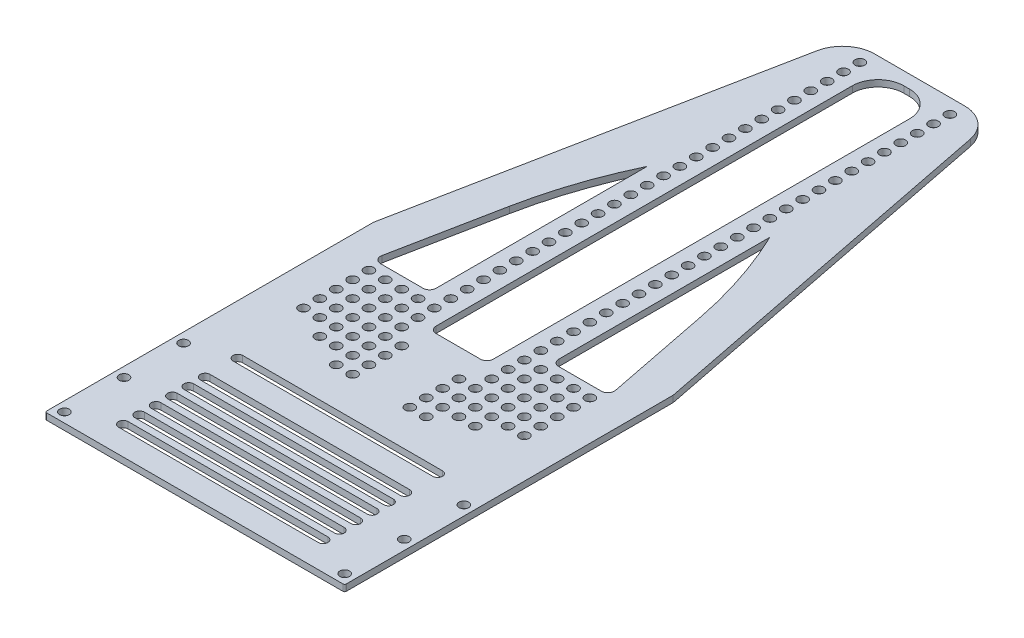
from build123d import *

# Parameters (mm, degrees)
SKETCH_1_R      = 1.5
EXTRUDE_1_DEPTH = 2


with BuildPart() as part:
    # 스케치1 → 보스-돌출1 (new body)
    with BuildSketch(Plane(origin=(0, 0, 0), x_dir=(1, 0, 0), z_dir=(0, 1, 0))):
        with BuildLine():
            Line((-13.97, 75), (13.97, 75))
            ThreePointArc((13.97, 75), (20.318558496, 72.72630604), (23.780181171, 66.939161004))
            Line((23.780181171, 66.939161004), (46.5, -48))
            Line((46.5, -48), (46.5, -149.5))
            ThreePointArc((46.5, -149.5), (46.353553391, -149.853553391), (46, -150))
            Line((46, -150), (-46, -150))
            ThreePointArc((-46, -150), (-46.353553391, -149.853553391), (-46.5, -149.5))
            Line((-46.5, -149.5), (-46.5, -48))
            Line((-46.5, -48), (-23.780181171, 66.939161004))
            ThreePointArc((-23.780181171, 66.939161004), (-20.318558496, 72.72630604), (-13.97, 75))
        make_face()
        with Locations(Location((-13.97, 65.34, 0), (0, 0, 270))):
            Circle(SKETCH_1_R, mode=Mode.SUBTRACT)
        with Locations(Location((-13.97, 60.26, 0), (0, 0, 270))):
            Circle(SKETCH_1_R, mode=Mode.SUBTRACT)
        with Locations(Location((-13.97, 70.42, 0), (0, 0, 270))):
            Circle(SKETCH_1_R, mode=Mode.SUBTRACT)
        with Locations(Location((-13.97, 55.18, 0), (0, 0, 270))):
            Circle(SKETCH_1_R, mode=Mode.SUBTRACT)
        with Locations(Location((-13.97, 50.1, 0), (0, 0, 270))):
            Circle(SKETCH_1_R, mode=Mode.SUBTRACT)
        with Locations(Location((-13.97, 45.02, 0), (0, 0, 270))):
            Circle(SKETCH_1_R, mode=Mode.SUBTRACT)
        with Locations(Location((-13.97, 39.94, 0), (0, 0, 270))):
            Circle(SKETCH_1_R, mode=Mode.SUBTRACT)
        with Locations(Location((-13.97, 34.86, 0), (0, 0, 270))):
            Circle(SKETCH_1_R, mode=Mode.SUBTRACT)
        with Locations(Location((-13.97, 29.78, 0), (0, 0, 270))):
            Circle(SKETCH_1_R, mode=Mode.SUBTRACT)
        with Locations(Location((-13.97, 24.7, 0), (0, 0, 270))):
            Circle(SKETCH_1_R, mode=Mode.SUBTRACT)
        with Locations(Location((-13.97, 19.62, 0), (0, 0, 270))):
            Circle(SKETCH_1_R, mode=Mode.SUBTRACT)
        with Locations(Location((-13.97, 14.54, 0), (0, 0, 270))):
            Circle(SKETCH_1_R, mode=Mode.SUBTRACT)
        with Locations(Location((-13.97, 9.46, 0), (0, 0, 270))):
            Circle(SKETCH_1_R, mode=Mode.SUBTRACT)
        with Locations(Location((-13.97, 4.38, 0), (0, 0, 270))):
            Circle(SKETCH_1_R, mode=Mode.SUBTRACT)
        with Locations(Location((-13.97, -0.7, 0), (0, 0, 270))):
            Circle(SKETCH_1_R, mode=Mode.SUBTRACT)
        with Locations(Location((-13.97, -5.78, 0), (0, 0, 270))):
            Circle(SKETCH_1_R, mode=Mode.SUBTRACT)
        with Locations(Location((-13.97, -10.86, 0), (0, 0, 270))):
            Circle(SKETCH_1_R, mode=Mode.SUBTRACT)
        with Locations(Location((-13.97, -15.94, 0), (0, 0, 270))):
            Circle(SKETCH_1_R, mode=Mode.SUBTRACT)
        with Locations(Location((-13.97, -21.02, 0), (0, 0, 270))):
            Circle(SKETCH_1_R, mode=Mode.SUBTRACT)
        with Locations(Location((-13.97, -26.1, 0), (0, 0, 270))):
            Circle(SKETCH_1_R, mode=Mode.SUBTRACT)
        with Locations(Location((-13.97, -31.18, 0), (0, 0, 270))):
            Circle(SKETCH_1_R, mode=Mode.SUBTRACT)
        with Locations(Location((-13.97, -36.26, 0), (0, 0, 270))):
            Circle(SKETCH_1_R, mode=Mode.SUBTRACT)
        with Locations(Location((-13.97, -41.34, 0), (0, 0, 270))):
            Circle(SKETCH_1_R, mode=Mode.SUBTRACT)
        with Locations(Location((-13.97, -46.42, 0), (0, 0, 270))):
            Circle(SKETCH_1_R, mode=Mode.SUBTRACT)
        with Locations(Location((-13.97, -51.5, 0), (0, 0, 270))):
            Circle(SKETCH_1_R, mode=Mode.SUBTRACT)
        with Locations(Location((-13.97, -56.58, 0), (0, 0, 270))):
            Circle(SKETCH_1_R, mode=Mode.SUBTRACT)
        with Locations(Location((-13.97, -61.66, 0), (0, 0, 270))):
            Circle(SKETCH_1_R, mode=Mode.SUBTRACT)
        with Locations(Location((-13.97, -66.74, 0), (0, 0, 270))):
            Circle(SKETCH_1_R, mode=Mode.SUBTRACT)
        with Locations(Location((-13.97, -71.82, 0), (0, 0, 270))):
            Circle(SKETCH_1_R, mode=Mode.SUBTRACT)
        with Locations(Location((-13.97, -76.9, 0), (0, 0, 270))):
            Circle(SKETCH_1_R, mode=Mode.SUBTRACT)
        with Locations(Location((-13.97, -81.98, 0), (0, 0, 270))):
            Circle(SKETCH_1_R, mode=Mode.SUBTRACT)
        with Locations(Location((-13.97, -87.06, 0), (0, 0, 270))):
            Circle(SKETCH_1_R, mode=Mode.SUBTRACT)
        with Locations(Location((-13.97, -92.14, 0), (0, 0, 270))):
            Circle(SKETCH_1_R, mode=Mode.SUBTRACT)
        with Locations(Location((-19.05, -61.66, 0), (0, 0, 270))):
            Circle(SKETCH_1_R, mode=Mode.SUBTRACT)
        with Locations(Location((-19.05, -66.74, 0), (0, 0, 270))):
            Circle(SKETCH_1_R, mode=Mode.SUBTRACT)
        with Locations(Location((-19.05, -71.82, 0), (0, 0, 270))):
            Circle(SKETCH_1_R, mode=Mode.SUBTRACT)
        with Locations(Location((-19.05, -76.9, 0), (0, 0, 270))):
            Circle(SKETCH_1_R, mode=Mode.SUBTRACT)
        with Locations(Location((-19.05, -81.98, 0), (0, 0, 270))):
            Circle(SKETCH_1_R, mode=Mode.SUBTRACT)
        with Locations(Location((-19.05, -87.06, 0), (0, 0, 270))):
            Circle(SKETCH_1_R, mode=Mode.SUBTRACT)
        with Locations(Location((-24.13, -61.66, 0), (0, 0, 270))):
            Circle(SKETCH_1_R, mode=Mode.SUBTRACT)
        with Locations(Location((-24.13, -66.74, 0), (0, 0, 270))):
            Circle(SKETCH_1_R, mode=Mode.SUBTRACT)
        with Locations(Location((-24.13, -71.82, 0), (0, 0, 270))):
            Circle(SKETCH_1_R, mode=Mode.SUBTRACT)
        with Locations(Location((-24.13, -76.9, 0), (0, 0, 270))):
            Circle(SKETCH_1_R, mode=Mode.SUBTRACT)
        with Locations(Location((-24.13, -81.98, 0), (0, 0, 270))):
            Circle(SKETCH_1_R, mode=Mode.SUBTRACT)
        with Locations(Location((-24.13, -87.06, 0), (0, 0, 270))):
            Circle(SKETCH_1_R, mode=Mode.SUBTRACT)
        with Locations(Location((-29.21, -61.66, 0), (0, 0, 270))):
            Circle(SKETCH_1_R, mode=Mode.SUBTRACT)
        with Locations(Location((-29.21, -66.74, 0), (0, 0, 270))):
            Circle(SKETCH_1_R, mode=Mode.SUBTRACT)
        with Locations(Location((-29.21, -71.82, 0), (0, 0, 270))):
            Circle(SKETCH_1_R, mode=Mode.SUBTRACT)
        with Locations(Location((-29.21, -76.9, 0), (0, 0, 270))):
            Circle(SKETCH_1_R, mode=Mode.SUBTRACT)
        with Locations(Location((-29.21, -81.98, 0), (0, 0, 270))):
            Circle(SKETCH_1_R, mode=Mode.SUBTRACT)
        with Locations(Location((-8.89, -76.9, 0), (0, 0, 270))):
            Circle(SKETCH_1_R, mode=Mode.SUBTRACT)
        with Locations(Location((-34.29, -61.66, 0), (0, 0, 270))):
            Circle(SKETCH_1_R, mode=Mode.SUBTRACT)
        with Locations(Location((-34.29, -66.74, 0), (0, 0, 270))):
            Circle(SKETCH_1_R, mode=Mode.SUBTRACT)
        with Locations(Location((-34.29, -71.82, 0), (0, 0, 270))):
            Circle(SKETCH_1_R, mode=Mode.SUBTRACT)
        with Locations(Location((-34.29, -76.9, 0), (0, 0, 270))):
            Circle(SKETCH_1_R, mode=Mode.SUBTRACT)
        with Locations(Location((-8.89, -81.98, 0), (0, 0, 270))):
            Circle(SKETCH_1_R, mode=Mode.SUBTRACT)
        with Locations(Location((-8.89, -87.06, 0), (0, 0, 270))):
            Circle(SKETCH_1_R, mode=Mode.SUBTRACT)
        with Locations(Location((-8.89, -92.14, 0), (0, 0, 270))):
            Circle(SKETCH_1_R, mode=Mode.SUBTRACT)
        with Locations(Location((13.97, 39.94, 0), (0, 0, 90))):
            Circle(SKETCH_1_R, mode=Mode.SUBTRACT)
        with Locations(Location((13.97, 45.02, 0), (0, 0, 90))):
            Circle(SKETCH_1_R, mode=Mode.SUBTRACT)
        with Locations(Location((13.97, 50.1, 0), (0, 0, 90))):
            Circle(SKETCH_1_R, mode=Mode.SUBTRACT)
        with Locations(Location((13.97, 55.18, 0), (0, 0, 90))):
            Circle(SKETCH_1_R, mode=Mode.SUBTRACT)
        with Locations(Location((13.97, 70.42, 0), (0, 0, 90))):
            Circle(SKETCH_1_R, mode=Mode.SUBTRACT)
        with Locations(Location((13.97, 60.26, 0), (0, 0, 90))):
            Circle(SKETCH_1_R, mode=Mode.SUBTRACT)
        with Locations(Location((13.97, 65.34, 0), (0, 0, 90))):
            Circle(SKETCH_1_R, mode=Mode.SUBTRACT)
        with Locations(Location((13.97, -41.34, 0), (0, 0, 90))):
            Circle(SKETCH_1_R, mode=Mode.SUBTRACT)
        with Locations(Location((13.97, -36.26, 0), (0, 0, 90))):
            Circle(SKETCH_1_R, mode=Mode.SUBTRACT)
        with Locations(Location((13.97, -31.18, 0), (0, 0, 90))):
            Circle(SKETCH_1_R, mode=Mode.SUBTRACT)
        with Locations(Location((13.97, -26.1, 0), (0, 0, 90))):
            Circle(SKETCH_1_R, mode=Mode.SUBTRACT)
        with Locations(Location((13.97, -21.02, 0), (0, 0, 90))):
            Circle(SKETCH_1_R, mode=Mode.SUBTRACT)
        with Locations(Location((13.97, -15.94, 0), (0, 0, 90))):
            Circle(SKETCH_1_R, mode=Mode.SUBTRACT)
        with Locations(Location((13.97, -10.86, 0), (0, 0, 90))):
            Circle(SKETCH_1_R, mode=Mode.SUBTRACT)
        with Locations(Location((13.97, -5.78, 0), (0, 0, 90))):
            Circle(SKETCH_1_R, mode=Mode.SUBTRACT)
        with Locations(Location((13.97, -0.7, 0), (0, 0, 90))):
            Circle(SKETCH_1_R, mode=Mode.SUBTRACT)
        with Locations(Location((13.97, 4.38, 0), (0, 0, 90))):
            Circle(SKETCH_1_R, mode=Mode.SUBTRACT)
        with Locations(Location((-43.5, -147, 0), (0, 0, 270))):
            Circle(SKETCH_1_R, mode=Mode.SUBTRACT)
        with Locations(Location((-43.5, -110, 0), (0, 0, 270))):
            Circle(SKETCH_1_R, mode=Mode.SUBTRACT)
        with Locations(Location((-43.5, -128.5, 0), (0, 0, 270))):
            Circle(SKETCH_1_R, mode=Mode.SUBTRACT)
        with Locations(Location((43.5, -147, 0), (0, 0, 90))):
            Circle(SKETCH_1_R, mode=Mode.SUBTRACT)
        with Locations(Location((43.5, -128.5, 0), (0, 0, 90))):
            Circle(SKETCH_1_R, mode=Mode.SUBTRACT)
        with Locations(Location((43.5, -110, 0), (0, 0, 90))):
            Circle(SKETCH_1_R, mode=Mode.SUBTRACT)
        with Locations(Location((13.97, 9.46, 0), (0, 0, 90))):
            Circle(SKETCH_1_R, mode=Mode.SUBTRACT)
        with Locations(Location((13.97, 14.54, 0), (0, 0, 90))):
            Circle(SKETCH_1_R, mode=Mode.SUBTRACT)
        with Locations(Location((13.97, 19.62, 0), (0, 0, 90))):
            Circle(SKETCH_1_R, mode=Mode.SUBTRACT)
        with Locations(Location((13.97, 24.7, 0), (0, 0, 90))):
            Circle(SKETCH_1_R, mode=Mode.SUBTRACT)
        with Locations(Location((13.97, 29.78, 0), (0, 0, 90))):
            Circle(SKETCH_1_R, mode=Mode.SUBTRACT)
        with Locations(Location((13.97, 34.86, 0), (0, 0, 90))):
            Circle(SKETCH_1_R, mode=Mode.SUBTRACT)
        with Locations(Location((13.97, -66.74, 0), (0, 0, 90))):
            Circle(SKETCH_1_R, mode=Mode.SUBTRACT)
        with Locations(Location((34.29, -66.74, 0), (0, 0, 90))):
            Circle(SKETCH_1_R, mode=Mode.SUBTRACT)
        with Locations(Location((29.21, -66.74, 0), (0, 0, 90))):
            Circle(SKETCH_1_R, mode=Mode.SUBTRACT)
        with Locations(Location((24.13, -66.74, 0), (0, 0, 90))):
            Circle(SKETCH_1_R, mode=Mode.SUBTRACT)
        with Locations(Location((19.05, -66.74, 0), (0, 0, 90))):
            Circle(SKETCH_1_R, mode=Mode.SUBTRACT)
        with Locations(Location((34.29, -61.66, 0), (0, 0, 90))):
            Circle(SKETCH_1_R, mode=Mode.SUBTRACT)
        with Locations(Location((29.21, -61.66, 0), (0, 0, 90))):
            Circle(SKETCH_1_R, mode=Mode.SUBTRACT)
        with Locations(Location((24.13, -61.66, 0), (0, 0, 90))):
            Circle(SKETCH_1_R, mode=Mode.SUBTRACT)
        with Locations(Location((19.05, -61.66, 0), (0, 0, 90))):
            Circle(SKETCH_1_R, mode=Mode.SUBTRACT)
        with Locations(Location((13.97, -61.66, 0), (0, 0, 90))):
            Circle(SKETCH_1_R, mode=Mode.SUBTRACT)
        with Locations(Location((13.97, -56.58, 0), (0, 0, 90))):
            Circle(SKETCH_1_R, mode=Mode.SUBTRACT)
        with Locations(Location((13.97, -51.5, 0), (0, 0, 90))):
            Circle(SKETCH_1_R, mode=Mode.SUBTRACT)
        with Locations(Location((13.97, -46.42, 0), (0, 0, 90))):
            Circle(SKETCH_1_R, mode=Mode.SUBTRACT)
        with Locations(Location((8.89, -92.14, 0), (0, 0, 90))):
            Circle(SKETCH_1_R, mode=Mode.SUBTRACT)
        with Locations(Location((8.89, -87.06, 0), (0, 0, 90))):
            Circle(SKETCH_1_R, mode=Mode.SUBTRACT)
        with Locations(Location((8.89, -81.98, 0), (0, 0, 90))):
            Circle(SKETCH_1_R, mode=Mode.SUBTRACT)
        with Locations(Location((34.29, -76.9, 0), (0, 0, 90))):
            Circle(SKETCH_1_R, mode=Mode.SUBTRACT)
        with Locations(Location((34.29, -71.82, 0), (0, 0, 90))):
            Circle(SKETCH_1_R, mode=Mode.SUBTRACT)
        with Locations(Location((8.89, -76.9, 0), (0, 0, 90))):
            Circle(SKETCH_1_R, mode=Mode.SUBTRACT)
        with Locations(Location((29.21, -76.9, 0), (0, 0, 90))):
            Circle(SKETCH_1_R, mode=Mode.SUBTRACT)
        with Locations(Location((29.21, -71.82, 0), (0, 0, 90))):
            Circle(SKETCH_1_R, mode=Mode.SUBTRACT)
        with Locations(Location((24.13, -87.06, 0), (0, 0, 90))):
            Circle(SKETCH_1_R, mode=Mode.SUBTRACT)
        with Locations(Location((24.13, -81.98, 0), (0, 0, 90))):
            Circle(SKETCH_1_R, mode=Mode.SUBTRACT)
        with Locations(Location((24.13, -76.9, 0), (0, 0, 90))):
            Circle(SKETCH_1_R, mode=Mode.SUBTRACT)
        with Locations(Location((24.13, -71.82, 0), (0, 0, 90))):
            Circle(SKETCH_1_R, mode=Mode.SUBTRACT)
        with Locations(Location((19.05, -87.06, 0), (0, 0, 90))):
            Circle(SKETCH_1_R, mode=Mode.SUBTRACT)
        with Locations(Location((19.05, -81.98, 0), (0, 0, 90))):
            Circle(SKETCH_1_R, mode=Mode.SUBTRACT)
        with Locations(Location((19.05, -76.9, 0), (0, 0, 90))):
            Circle(SKETCH_1_R, mode=Mode.SUBTRACT)
        with Locations(Location((19.05, -71.82, 0), (0, 0, 90))):
            Circle(SKETCH_1_R, mode=Mode.SUBTRACT)
        with Locations(Location((13.97, -92.14, 0), (0, 0, 90))):
            Circle(SKETCH_1_R, mode=Mode.SUBTRACT)
        with Locations(Location((13.97, -87.06, 0), (0, 0, 90))):
            Circle(SKETCH_1_R, mode=Mode.SUBTRACT)
        with Locations(Location((13.97, -81.98, 0), (0, 0, 90))):
            Circle(SKETCH_1_R, mode=Mode.SUBTRACT)
        with Locations(Location((13.97, -76.9, 0), (0, 0, 90))):
            Circle(SKETCH_1_R, mode=Mode.SUBTRACT)
        with Locations(Location((13.97, -71.82, 0), (0, 0, 90))):
            Circle(SKETCH_1_R, mode=Mode.SUBTRACT)
        with Locations(Location((-34.29, -81.98, 0), (0, 0, 270))):
            Circle(SKETCH_1_R, mode=Mode.SUBTRACT)
        with Locations(Location((34.29, -81.98, 0), (0, 0, 90))):
            Circle(SKETCH_1_R, mode=Mode.SUBTRACT)
        with Locations(Location((29.21, -81.98, 0), (0, 0, 90))):
            Circle(SKETCH_1_R, mode=Mode.SUBTRACT)
        with BuildLine():
            Line((-0.890580049, 70.966353468), (0.889419951, 70.966353468))
            ThreePointArc((0.889419951, 70.966353468), (6.546649167, 68.623412813), (8.89, 62.966353489))
            Line((8.89, 62.966353489), (8.89, -66.24))
            ThreePointArc((8.89, -66.24), (8.304213562, -67.654213562), (6.89, -68.24))
            Line((6.89, -68.24), (-6.89, -68.24))
            ThreePointArc((-6.89, -68.24), (-8.304213562, -67.654213562), (-8.89, -66.24))
            Line((-8.89, -66.24), (-8.89, 62.966353489))
            ThreePointArc((-8.89, 62.966353489), (-6.547059324, 68.623002656), (-0.890580049, 70.966353468))
        make_face(mode=Mode.SUBTRACT)
        with BuildLine():
            Line((36.252036234, -55.692167799), (29.723666178, -22.665259327))
            ThreePointArc((29.723666178, -22.665259327), (25.397089126, -6.266970562), (19.05, 9.46))
            Line((19.05, 9.46), (19.05, -56.08))
            ThreePointArc((19.05, -56.08), (19.635786438, -57.494213562), (21.05, -58.08))
            Line((21.05, -58.08), (34.29, -58.08))
            ThreePointArc((34.29, -58.08), (35.835261208, -57.349711699), (36.252036234, -55.692167799))
        make_face(mode=Mode.SUBTRACT)
        with BuildLine():
            Line((-19.05, 9.46), (-19.05, -56.08))
            ThreePointArc((-19.05, -56.08), (-19.635786438, -57.494213562), (-21.05, -58.08))
            Line((-21.05, -58.08), (-34.29, -58.08))
            ThreePointArc((-34.29, -58.08), (-35.835261208, -57.349711699), (-36.252036234, -55.692167799))
            Line((-36.252036234, -55.692167799), (-29.723666178, -22.665259327))
            ThreePointArc((-29.723666178, -22.665259327), (-25.397089126, -6.266970562), (-19.05, 9.46))
        make_face(mode=Mode.SUBTRACT)
        with BuildLine():
            Line((-31.015927995, -137.62), (30.984072005, -137.62))
            ThreePointArc((30.984072005, -137.62), (32.500084565, -136.12), (30.984072005, -134.62))
            Line((30.984072005, -134.62), (-31.015927995, -134.62))
            ThreePointArc((-31.015927995, -134.62), (-32.500084565, -136.12), (-31.015927995, -137.62))
        make_face(mode=Mode.SUBTRACT)
        with BuildLine():
            Line((-31.015927995, -142.7), (30.984072005, -142.7))
            ThreePointArc((30.984072005, -142.7), (32.500084565, -141.2), (30.984072005, -139.7))
            Line((30.984072005, -139.7), (-31.015927995, -139.7))
            ThreePointArc((-31.015927995, -139.7), (-32.500084565, -141.2), (-31.015927995, -142.7))
        make_face(mode=Mode.SUBTRACT)
        with BuildLine():
            Line((-31.015927995, -132.54), (30.984072005, -132.54))
            ThreePointArc((30.984072005, -132.54), (32.500084565, -131.04), (30.984072005, -129.54))
            Line((30.984072005, -129.54), (-31.015927995, -129.54))
            ThreePointArc((-31.015927995, -129.54), (-32.500084565, -131.04), (-31.015927995, -132.54))
        make_face(mode=Mode.SUBTRACT)
        with BuildLine():
            Line((-31.015927995, -127.46), (30.984072005, -127.46))
            ThreePointArc((30.984072005, -127.46), (32.500084565, -125.96), (30.984072005, -124.46))
            Line((30.984072005, -124.46), (-31.015927995, -124.46))
            ThreePointArc((-31.015927995, -124.46), (-32.500084565, -125.96), (-31.015927995, -127.46))
        make_face(mode=Mode.SUBTRACT)
        with BuildLine():
            Line((-31.015927995, -122.38), (30.984072005, -122.38))
            ThreePointArc((30.984072005, -122.38), (32.500084565, -120.88), (30.984072005, -119.38))
            Line((30.984072005, -119.38), (-31.015927995, -119.38))
            ThreePointArc((-31.015927995, -119.38), (-32.500084565, -120.88), (-31.015927995, -122.38))
        make_face(mode=Mode.SUBTRACT)
        with BuildLine():
            Line((-31.015927995, -117.3), (30.984072005, -117.3))
            ThreePointArc((30.984072005, -117.3), (32.500084565, -115.8), (30.984072005, -114.3))
            Line((30.984072005, -114.3), (-31.015927995, -114.3))
            ThreePointArc((-31.015927995, -114.3), (-32.500084565, -115.8), (-31.015927995, -117.3))
        make_face(mode=Mode.SUBTRACT)
        with BuildLine():
            Line((-31.015927995, -107.14), (30.984072005, -107.14))
            ThreePointArc((30.984072005, -107.14), (32.500084565, -105.64), (30.984072005, -104.14))
            Line((30.984072005, -104.14), (-31.015927995, -104.14))
            ThreePointArc((-31.015927995, -104.14), (-32.500084565, -105.64), (-31.015927995, -107.14))
        make_face(mode=Mode.SUBTRACT)
    extrude(amount=EXTRUDE_1_DEPTH)


solid = part.part
